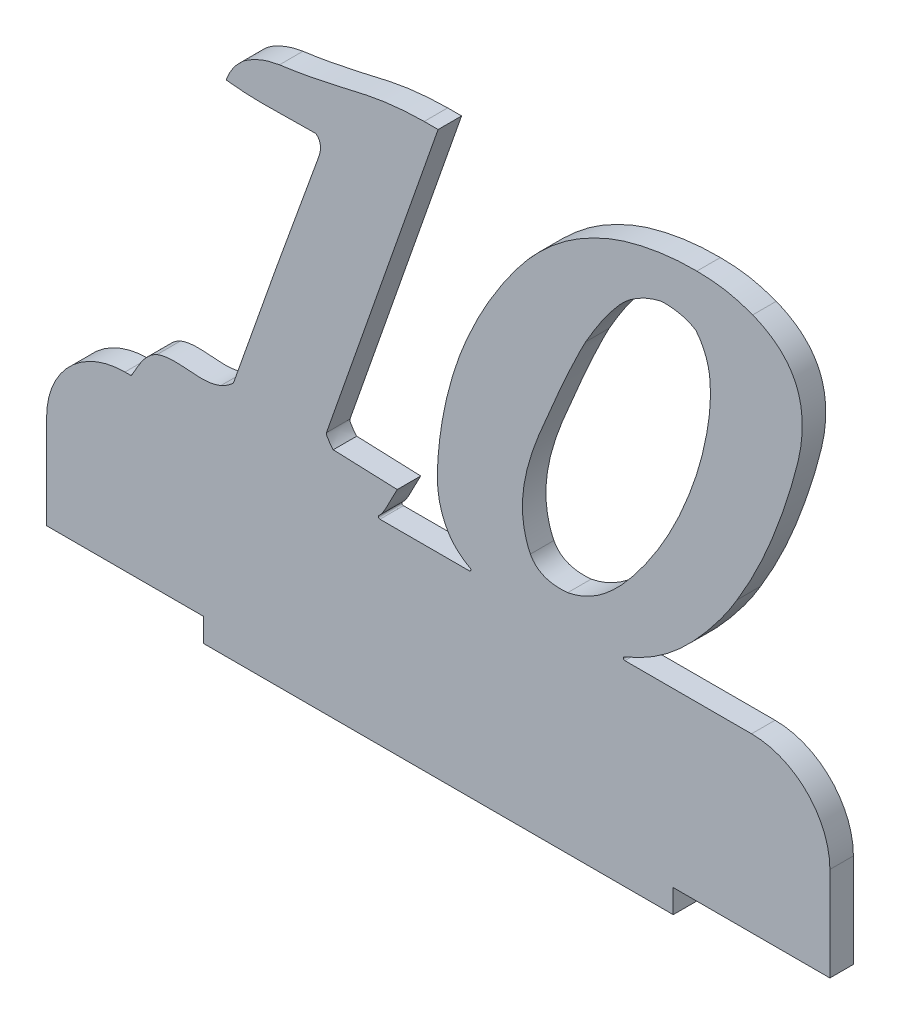
from build123d import *

# Parameters (mm, degrees)
BOSS_EXTRUDE1_DEPTH = 3
FILLET1_R           = 10
FILLET2_R           = 0.2


with BuildPart() as part:
    # Sketch1 → Boss-Extrude1 (new body)
    with BuildSketch(Plane.XY):
        with BuildLine():
            Line((41.953838271, 22.000000982), (54.89640752, 22.000000982))
            add(Edge.make_bspline(
                [(54.89640752, 22.000000982), (54.660497211, 22.090407069), (53.959824737, 22.390381424), (52.900059231, 23.079803144), (51.790096235, 24.098863684), (50.960222828, 25.376134532), (50.354740575, 26.847664733), (49.801116168, 29.212506915), (49.870748399, 31.13221349), (49.961090666, 32.446746755)],
                knots=[0.534065797, 0.534065797, 0.534065797, 0.534065797, 0.562299825, 0.61931963, 0.674487907, 0.729675441, 0.788153341, 0.851799168, 1, 1, 1, 1], degree=3))
            add(Edge.make_bspline(
                [(49.961090666, 32.446746755), (50.128014732, 34.674843163), (50.617207602, 38.000416789), (51.746594075, 42.337220907), (52.80942647, 45.546584289), (54.164049912, 48.679921806), (55.702048137, 51.785751031), (57.509784666, 54.828899972), (59.516869742, 57.796033995), (61.714408178, 60.585382691), (64.188662984, 63.004196492), (66.830927418, 65.091828179), (69.711147672, 66.739218973), (72.746647668, 68.087060663), (77.169055345, 69.309389399), (80.647774201, 69.694103678), (83.014257202, 69.663322205)],
                knots=[0, 0, 0, 0, 0.122246067, 0.183381441, 0.245050885, 0.307031795, 0.37001055, 0.434578783, 0.500534692, 0.565957523, 0.628479512, 0.689453544, 0.749684058, 0.80955899, 0.870724503, 1, 1, 1, 1], degree=3))
            add(Edge.make_bspline(
                [(83.014257202, 69.663322205), (84.274496657, 69.652872351), (86.717335939, 69.50935642), (89.057489862, 68.799500625), (90.148737265, 68.392798358)],
                knots=[0, 0, 0, 0, 0.519885394, 1, 1, 1, 1], degree=3))
            add(Edge.make_bspline(
                [(90.148737265, 68.392798358), (91.416284678, 67.877500146), (93.211337336, 66.884150175), (94.950650003, 64.901238155), (95.860172095, 63.227764035), (96.375454677, 61.322845221), (96.540765651, 59.205799859), (96.347658214, 56.875031315), (95.598257949, 53.535623772), (94.319737602, 49.369195687), (92.018553992, 43.065616173), (89.821637809, 38.639338782), (88.154992151, 35.886934402)],
                knots=[0, 0, 0, 0, 0.111905612, 0.162582178, 0.212592743, 0.265416324, 0.321765959, 0.384451445, 0.45478123, 0.599580751, 0.738515281, 1, 1, 1, 1], degree=3))
            add(Edge.make_bspline(
                [(88.154992151, 35.886934402), (87.063508033, 34.029722119), (85.1932106, 31.459247632), (82.44385922, 28.336264523), (80.275164323, 26.266996689), (77.892732646, 24.459334236), (75.358390397, 23.044690589), (73.596374924, 22.3081304), (72.752694988, 22.000000982)],
                knots=[0, 0, 0, 0, 0.257859597, 0.380113614, 0.498337489, 0.61657684, 0.737567111, 0.845152661, 0.845152661, 0.845152661, 0.845152661], degree=3))
            Line((72.752694988, 22.000000982), (100, 22.000000982))
            Line((100, 22.000000982), (100, 0))
            Line((100, 0), (80, 0))
            Line((80, 0), (80, -3))
            Line((80, -3), (20, -3))
            Line((20, -3), (20, 0))
            Line((20, 0), (0, 0))
            Line((0, 0), (0, 22.000000982))
            Line((0, 22.000000982), (10.810641509, 22.000000982))
            add(Edge.make_bspline(
                [(10.810641509, 22.000000982), (10.93757677, 22.209493657), (11.308496946, 22.854144953), (12.157830964, 24.377760066), (13.152450299, 25.547370877), (14.093225146, 25.976848397)],
                knots=[0.1262572, 0.1262572, 0.1262572, 0.1262572, 0.24891213, 0.498932816, 1, 1, 1, 1], degree=3))
            add(Edge.make_bspline(
                [(14.093225146, 25.976848397), (15.43459344, 26.496112408), (18.185331204, 26.221344348), (20.954664627, 26.065696248), (22.263670806, 26.641430102)],
                knots=[0, 0, 0, 0, 0.501451854, 1, 1, 1, 1], degree=3))
            add(Edge.make_bspline(
                [(22.263670806, 26.641430102), (23.145213744, 27.031942655), (23.846938985, 27.696942221)],
                knots=[0, 0, 0, 1, 1, 1], degree=2))
            add(Edge.make_bspline(
                [(23.846938985, 27.696942221), (25.629234863, 32.732115221), (29.154232066, 42.854916476), (32.843260059, 52.919113227), (34.675711463, 57.974502815)],
                knots=[0, 0, 0, 0, 0.498322561, 1, 1, 1, 1], degree=3))
            add(Edge.make_bspline(
                [(34.675711463, 57.974502815), (34.858888529, 58.472041028), (35.154074656, 59.438616802), (34.701480884, 60.350012274), (34.343420611, 60.55464355)],
                knots=[0, 0, 0, 0, 0.581397084, 1, 1, 1, 1], degree=3))
            add(Edge.make_bspline(
                [(34.343420611, 60.55464355), (32.426699728, 60.588440622), (28.621708849, 60.404532219), (24.80872713, 60.509269096), (22.928252511, 60.750108757)],
                knots=[0, 0, 0, 0, 0.503014916, 1, 1, 1, 1], degree=3))
            add(Edge.make_bspline(
                [(22.928252511, 60.750108757), (23.16021502, 61.417281252), (23.644458631, 62.366235287), (24.562452746, 63.426971459), (25.335736487, 64.149496495), (26.28369818, 64.703205086), (27.71071619, 65.385904708), (28.90277387, 65.700721582), (29.730441721, 65.832204144)],
                knots=[0, 0, 0, 0, 0.237267367, 0.352023708, 0.469658656, 0.590380818, 0.718477308, 1, 1, 1, 1], degree=3))
            add(Edge.make_bspline(
                [(29.730441721, 65.832204144), (32.842707747, 66.230641287), (36.704475341, 67.082645245), (41.326274895, 68.16245945), (44.406175989, 68.644935195), (46.699267282, 68.792485634), (48.201903801, 68.803275293)],
                knots=[0, 0, 0, 0, 0.501477793, 0.632810111, 0.759518477, 1, 1, 1, 1], degree=3))
            add(Edge.make_bspline(
                [(48.201903801, 68.803275293), (48.410400022, 68.803275293), (49.00331115, 68.803275293), (49.596222279, 68.803275293), (49.980637186, 68.803275293)],
                knots=[0, 0, 0, 0, 0.351648352, 1, 1, 1, 1], degree=3))
            Line((49.980637186, 68.803275293), (35.731223582, 28.166058718))
            add(Edge.make_bspline(
                [(35.731223582, 28.166058718), (35.678040927, 27.966262223), (36.009680662, 27.456569164), (36.28737101, 26.97378629), (36.591270494, 26.700069664)],
                knots=[0, 0, 0, 0, 0.324502414, 1, 1, 1, 1], degree=3))
            Line((36.591270494, 26.700069664), (44.761716154, 26.387325332))
            add(Edge.make_bspline(
                [(44.761716154, 26.387325332), (44.16677659, 25.374106206), (43.621616481, 24.051866829), (42.723640196, 22.585670733), (42.264464665, 22.207080581), (41.997606856, 22.028297053), (41.953838271, 22.000000982)],
                knots=[0, 0, 0, 0, 0.504343167, 0.619768133, 0.735364226, 0.757778054, 0.757778054, 0.757778054, 0.757778054], degree=3))
        make_face()
        with BuildLine():
            add(Edge.make_bspline(
                [(82.877431557, 63.056598202), (82.276171591, 63.466115352), (80.810883285, 63.972259547), (79.273087245, 64.099554683), (78.459917874, 64.053470759)],
                knots=[0, 0, 0, 0, 0.469698931, 1, 1, 1, 1], degree=3))
            add(Edge.make_bspline(
                [(78.459917874, 64.053470759), (77.315216603, 63.812782256), (75.697177695, 63.135253951), (73.808790751, 61.757688202), (71.500884073, 59.179627927), (69.96718631, 56.72804388), (68.82348316, 54.749326896)],
                knots=[0, 0, 0, 0, 0.252589616, 0.375811021, 0.503770371, 1, 1, 1, 1], degree=3))
            add(Edge.make_bspline(
                [(68.82348316, 54.749326896), (68.367204344, 53.951271142), (67.76898453, 52.634705516), (66.877471369, 50.815643157), (66.164003708, 49.234095207), (65.399622184, 47.514866723), (64.59913488, 45.648137879), (63.742536081, 43.651929778), (62.870472064, 41.563608069), (62.077483572, 39.465432075), (61.445827864, 37.438078889), (61.005022324, 35.530985184), (60.762120839, 33.737941341), (60.714807011, 32.058656811), (60.916511182, 30.032957604), (61.336019188, 28.609300253), (61.76718918, 27.755581783)],
                knots=[0, 0, 0, 0, 0.095871325, 0.150956838, 0.211549603, 0.277044413, 0.347448488, 0.423659813, 0.503898773, 0.583776288, 0.6578152, 0.725493304, 0.78794858, 0.846481479, 0.900510454, 1, 1, 1, 1], degree=3))
            add(Edge.make_bspline(
                [(61.76718918, 27.755581783), (62.125636021, 27.012564765), (63.625110078, 25.805289283), (65.538011124, 25.788701032), (66.516993715, 25.859569273)],
                knots=[0, 0, 0, 0, 0.446153942, 1, 1, 1, 1], degree=3))
            add(Edge.make_bspline(
                [(66.516993715, 25.859569273), (67.974518213, 26.133924482), (70.131113481, 27.152345047), (72.663414999, 29.320114579), (74.613876948, 31.477307157), (76.480675987, 33.962826329), (78.242201753, 36.636828125), (79.832649891, 39.463314723), (81.22717781, 42.419562723), (82.425327978, 45.436547183), (83.416862957, 48.448609032), (84.135544846, 51.437105886), (84.640082055, 54.327709234), (84.809698874, 57.02946449), (84.60783274, 60.060027655), (83.732986128, 62.048579119), (82.877431557, 63.056598202)],
                knots=[0, 0, 0, 0, 0.099522769, 0.157975555, 0.224341199, 0.295661745, 0.367825167, 0.440561069, 0.514605516, 0.588508481, 0.659789613, 0.728660389, 0.796041852, 0.857776262, 0.9112652, 1, 1, 1, 1], degree=3))
        make_face(mode=Mode.SUBTRACT)
    extrude(amount=BOSS_EXTRUDE1_DEPTH)

    # Fillet1
    fillet1_edges = [part.edges().sort_by_distance(p)[0] for p in [
        (100, 22.000000982, 1.5),
        (0, 22.000000982, 1.5),
    ]]
    fillet(fillet1_edges, radius=FILLET1_R)

    # Fillet2
    fillet2_edges = [part.edges().sort_by_distance(p)[0] for p in [
        (72.752694988, 22.000000982, 1.5),
        (54.89640752, 22.000000982, 1.5),
        (41.953838271, 22.000000982, 1.5),
        (10.810641509, 22.000000982, 1.5),
    ]]
    fillet(fillet2_edges, radius=FILLET2_R)


solid = part.part
